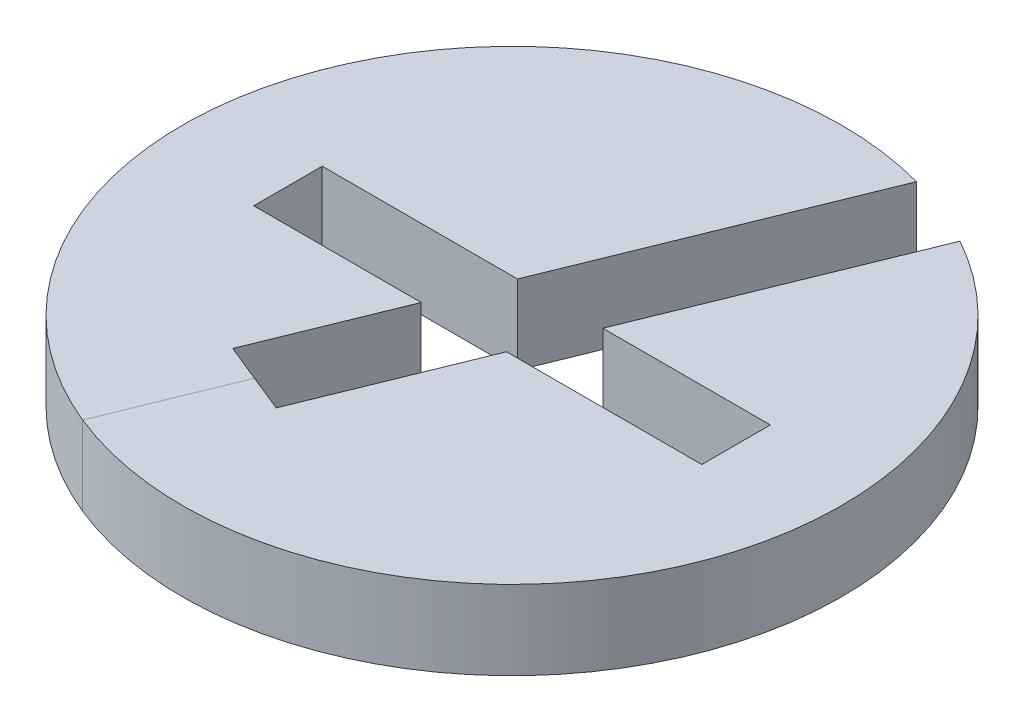
from build123d import *

# Parameters (mm, degrees)
BOSS_EXTRUDE1_DEPTH      = 1.5
BOSS_EXTRUDE1_DEPTH_BACK = 1.5
SKETCH1_R                = 12.5
SKETCH2_W                = 17
SKETCH2_H                = 2.6
CUT_EXTRUDE1_DEPTH       = 18.930421077
CUT_EXTRUDE2_DEPTH       = 18.741194999
CUT_EXTRUDE2_DEPTH_BACK  = 18.741194999


with BuildPart() as part:
    # Sketch1 → Boss-Extrude1 (new, two sides: drawn at the far end of the back side and taken through both)
    with BuildSketch(Plane(origin=(0, 0, 0), x_dir=(1, 0, 0), z_dir=(0, 1, 0)).offset(-BOSS_EXTRUDE1_DEPTH_BACK)):
        Circle(SKETCH1_R)
    extrude(amount=BOSS_EXTRUDE1_DEPTH + BOSS_EXTRUDE1_DEPTH_BACK)

    # Sketch2 → Cut-Extrude1 (cut, through all)
    with BuildSketch(Plane.XZ.offset(1.5)):
        Rectangle(SKETCH2_W, SKETCH2_H)
    extrude(amount=-CUT_EXTRUDE1_DEPTH, mode=Mode.SUBTRACT)

    # Sketch3 → Cut-Extrude2 (cut, two sides: drawn at the far end of the back side and taken through both)
    with BuildSketch(Plane.XZ.offset(-CUT_EXTRUDE2_DEPTH_BACK)):
        Polygon((3.313010343, -12.145944281), (-4.21147492, 6.384628337), (-1.431889027, 7.513301126), (6.092596236, -11.017271491), align=None)
    extrude(amount=CUT_EXTRUDE2_DEPTH + CUT_EXTRUDE2_DEPTH_BACK, mode=Mode.SUBTRACT)


with BuildPart() as body_2:
    # Split2: the piece on the far side of the plane
    add(part.part)
    split(bisect_by=Plane(origin=(0, 0, 0), x_dir=(0.3762242631393602, 0, -0.9265286308718395), z_dir=(-0.9265286308718397, 0, -0.37622426313936025)), keep=Keep.BOTTOM)


with BuildPart() as part_1:
    add(part.part)

    # Split2
    split(bisect_by=Plane(origin=(0, 0, 0), x_dir=(0.3762242631393602, 0, -0.9265286308718395), z_dir=(-0.9265286308718397, 0, -0.37622426313936025)), keep=Keep.TOP)


solid = Compound([body_2.part, part_1.part])
